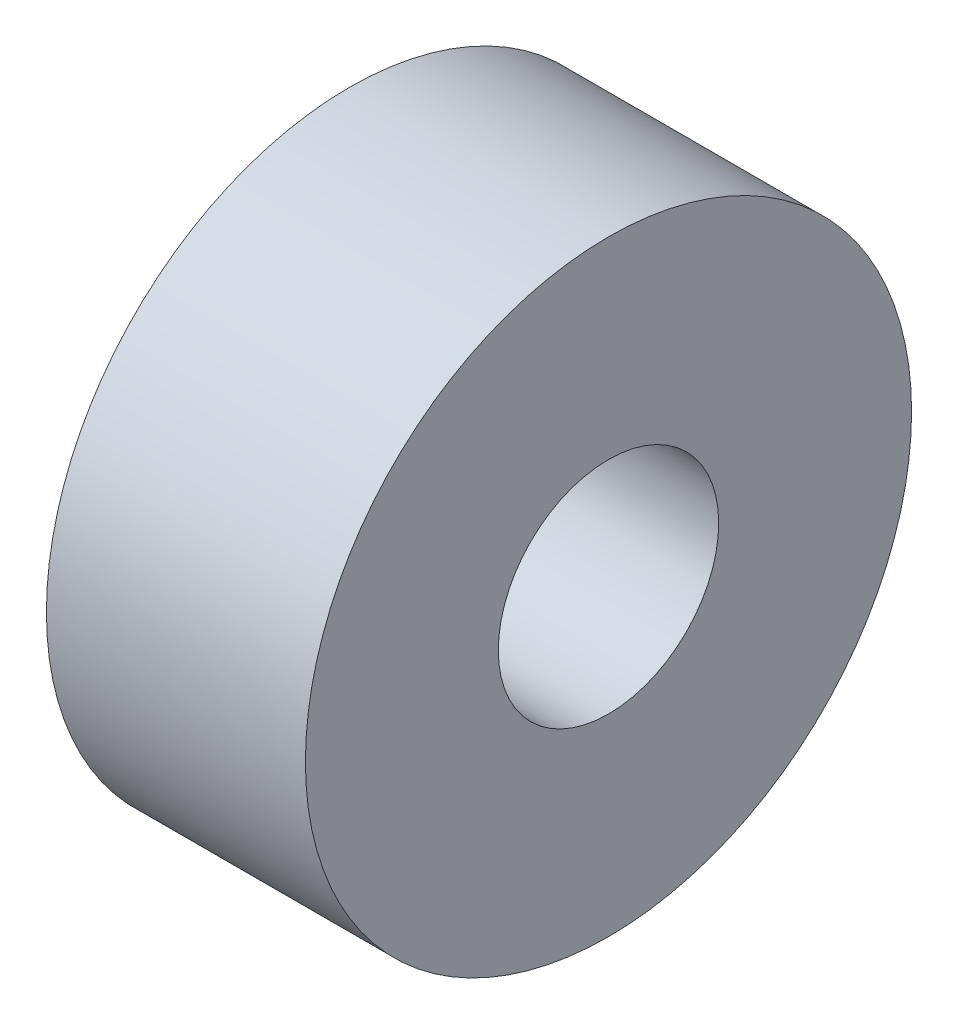
from build123d import *

# Parameters (mm, degrees)
SKETCH_1_R          = 2.75
EXTRUDE_1_DEPTH     = 2.35
SKETCH_2_R          = 1
CUT_EXTRUDE_1_DEPTH = 5.543952024


with BuildPart() as part:
    # 草图1 → 凸台-拉伸1 (new body)
    with BuildSketch(Plane(origin=(0, 0, 0), x_dir=(0, 0, -1), z_dir=(1, 0, 0))):
        Circle(SKETCH_1_R)
    extrude(amount=EXTRUDE_1_DEPTH)

    # 草图2 → 切除-拉伸1 (cut, through all)
    with BuildSketch(Plane(origin=(2.35, 0, 0), x_dir=(0, 0, -1), z_dir=(1, 0, 0))):
        Circle(SKETCH_2_R)
    extrude(amount=-CUT_EXTRUDE_1_DEPTH, mode=Mode.SUBTRACT)


solid = part.part
